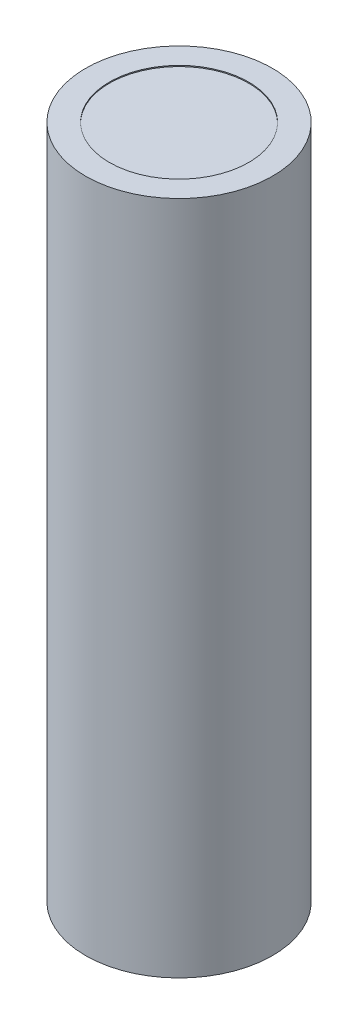
from build123d import *

# Parameters (mm, degrees)
SKETCH1_R           = 9
BOSS_EXTRUDE1_DEPTH = 65
SKETCH2_R           = 6.711393828
CUT_EXTRUDE1_DEPTH  = 0.1
SKETCH3_R           = 7.318356246
CUT_EXTRUDE2_DEPTH  = 0.1


with BuildPart() as part:
    # Sketch1 → Boss-Extrude1 (new body)
    with BuildSketch(Plane(origin=(0, 0, 0), x_dir=(1, 0, 0), z_dir=(0, 1, 0))):
        with Locations(Location((0, 0, 0), (0, 0, 270))):
            Circle(SKETCH1_R)
    extrude(amount=BOSS_EXTRUDE1_DEPTH)

    # Sketch2 → Cut-Extrude1 (cut)
    with BuildSketch(Plane(origin=(0, 65, 0), x_dir=(1, 0, 0), z_dir=(0, 1, 0))):
        with Locations(Location((0, 0, 0), (0, 0, 270))):
            Circle(SKETCH2_R)
    extrude(amount=-CUT_EXTRUDE1_DEPTH, mode=Mode.SUBTRACT)

    # Sketch3 → Cut-Extrude2 (cut)
    with BuildSketch(Plane.XZ):
        with Locations(Location((0, 0, 0), (0, 0, 270))):
            Circle(SKETCH3_R)
    extrude(amount=-CUT_EXTRUDE2_DEPTH, mode=Mode.SUBTRACT)


solid = part.part
